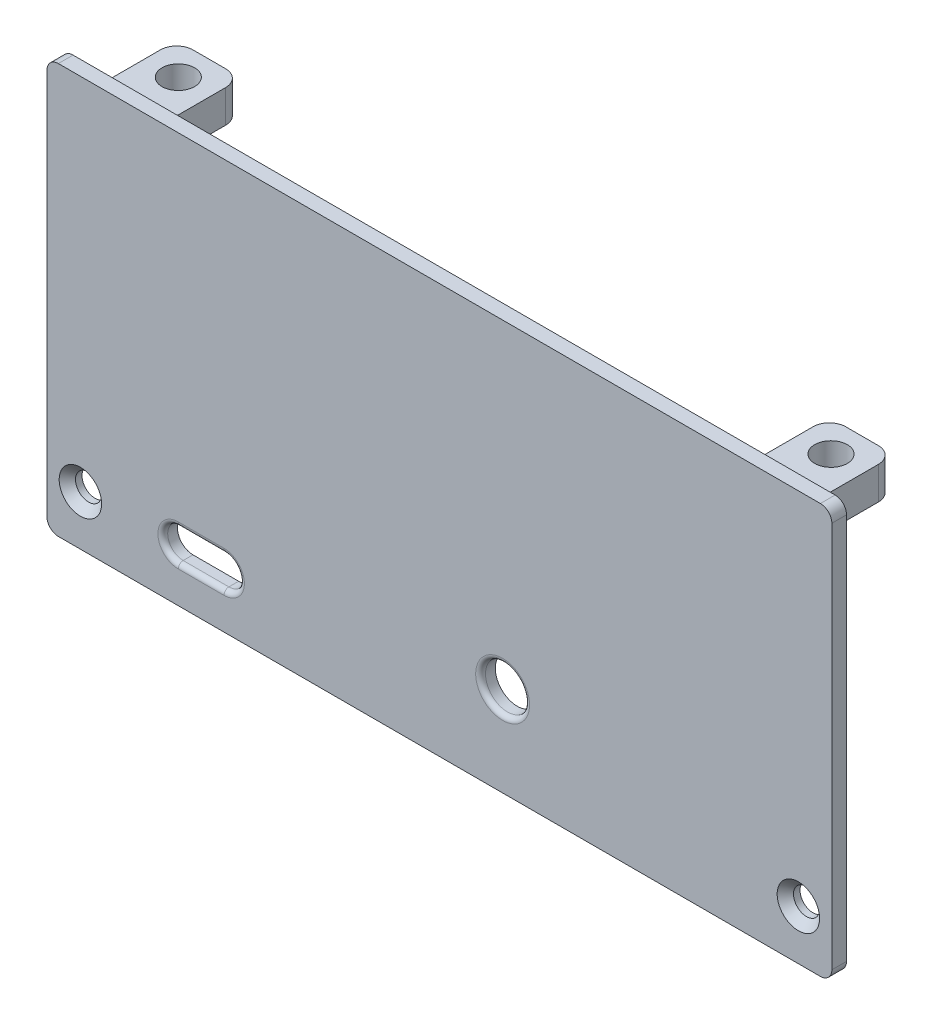
from build123d import *

# Parameters (mm, degrees)
SKETCH1_W            = 97
SKETCH1_H            = 51
SKETCH1_R            = 1.6
BOSS_EXTRUDE1_DEPTH  = 1.8
FILLET1_R            = 2
SKETCH4_W            = 8
SKETCH4_H            = 10
SKETCH4_R            = 2
BOSS_EXTRUDE3_DEPTH  = 4
FILLET2_R            = 2
FILLET2_OF_MIRROR1_R = 2
BOSS_EXTRUDE4_DEPTH  = 7
SKETCH7_R            = 2.7
CUT_EXTRUDE3_DEPTH   = 111.223590941
CUT_EXTRUDE4_DEPTH   = 111.223590941
FILLET3_R            = 0.6
CHAMFER1_SIZE        = 1
SKETCH9_W            = 97
SKETCH9_H            = 51
CUT_EXTRUDE5_DEPTH   = 111.223590941


with BuildPart() as part:
    # Sketch1 → Boss-Extrude1 (new body)
    with BuildSketch(Plane.XY):
        with Locations((48.5, -25.5)):
            Rectangle(SKETCH1_W, SKETCH1_H)
        with Locations((92.5, -44.5)):
            Circle(SKETCH1_R, mode=Mode.SUBTRACT)
        with Locations((4.5, -44.5)):
            Circle(SKETCH1_R, mode=Mode.SUBTRACT)
    extrude(amount=BOSS_EXTRUDE1_DEPTH)

    # Fillet1
    fillet1_edges = [part.edges().sort_by_distance(p)[0] for p in [
        (0, 0, 0.9),
        (97, 0, 0.9),
        (97, -51, 0.9),
        (0, -51, 0.9),
    ]]
    fillet(fillet1_edges, radius=FILLET1_R)

    # Sketch4 → Boss-Extrude3 (add)
    with BuildSketch(Plane(origin=(0, -2.5, 0), x_dir=(1, 0, 0), z_dir=(0, 1, 0))):
        with Locations((88.5, 5)):
            Rectangle(SKETCH4_W, SKETCH4_H)
        with Locations(Location((88.5, 6.2, 0), (0, 0, 270))):
            Circle(SKETCH4_R, mode=Mode.SUBTRACT)
    boss_extrude3 = extrude(amount=-BOSS_EXTRUDE3_DEPTH)

    # Fillet2
    fillet2_edges = [part.edges().sort_by_distance(p)[0] for p in [
        (84.5, -4.5, -10),
        (92.5, -4.5, -10),
    ]]
    fillet(fillet2_edges, radius=FILLET2_R)

    # Mirror1: Boss-Extrude3 across plane
    add(boss_extrude3.mirror(Plane(origin=(48.5, 0, 0), x_dir=(0, 0, 1), z_dir=(1, 0, 0))))

    # Fillet2 of Mirror1
    fillet2_of_mirror1_edges = [part.edges().sort_by_distance(p)[0] for p in [
        (12.5, -4.5, -10),
        (4.5, -4.5, -10),
    ]]
    fillet(fillet2_of_mirror1_edges, radius=FILLET2_OF_MIRROR1_R)

    # Sketch5 → Boss-Extrude4 (add)
    with BuildSketch(Plane(origin=(0, 0, 0), x_dir=(-1, 0, 0), z_dir=(0, 0, -1))):
        with BuildLine():
            Line((-89.15, -10), (-89.15, -31.3))
            ThreePointArc((-89.15, -31.3), (-88.564213562, -32.714213562), (-87.15, -33.3))
            Line((-87.15, -33.3), (-9.85, -33.3))
            ThreePointArc((-9.85, -33.3), (-8.435786438, -32.714213562), (-7.85, -31.3))
            Line((-7.85, -31.3), (-7.85, -10))
            ThreePointArc((-7.85, -10), (-8.435786438, -8.585786438), (-9.85, -8))
            Line((-9.85, -8), (-87.15, -8))
            ThreePointArc((-87.15, -8), (-88.564213562, -8.585786438), (-89.15, -10))
        make_face()
        with BuildLine():
            Line((-86.65, -10), (-10.35, -10))
            ThreePointArc((-10.35, -10), (-9.496446609, -9.646446609), (-9.85, -10.5))
            Line((-9.85, -10.5), (-9.85, -30.8))
            ThreePointArc((-9.85, -30.8), (-9.496446609, -31.653553391), (-10.35, -31.3))
            Line((-10.35, -31.3), (-86.65, -31.3))
            ThreePointArc((-86.65, -31.3), (-87.503553391, -31.653553391), (-87.15, -30.8))
            Line((-87.15, -30.8), (-87.15, -10.5))
            ThreePointArc((-87.15, -10.5), (-87.503553391, -9.646446609), (-86.65, -10))
        make_face(mode=Mode.SUBTRACT)
    extrude(amount=BOSS_EXTRUDE4_DEPTH)

    # Sketch7 → Cut-Extrude3 (cut, through all)
    with BuildSketch(Plane.XY.offset(1.8)):
        with Locations((56.25, -39.6)):
            Circle(SKETCH7_R)
    extrude(amount=-CUT_EXTRUDE3_DEPTH, mode=Mode.SUBTRACT)

    # Sketch8 → Cut-Extrude4 (cut, through all)
    with BuildSketch(Plane.XY.offset(1.8)):
        with BuildLine():
            Line((16.5, -42.3), (22.1, -42.3))
            ThreePointArc((22.1, -42.3), (24, -44.2), (22.1, -46.1))
            Line((22.1, -46.1), (16.5, -46.1))
            ThreePointArc((16.5, -46.1), (14.6, -44.2), (16.5, -42.3))
        make_face()
    extrude(amount=-CUT_EXTRUDE4_DEPTH, mode=Mode.SUBTRACT)

    # Fillet3
    fillet3_edges = [part.edges().sort_by_distance(p)[0] for p in [
        (53.55, -39.6, 1.8),
        (14.6, -44.2, 1.8),
        (19.3, -46.1, 1.8),
        (24, -44.2, 1.8),
        (19.3, -42.3, 1.8),
    ]]
    fillet(fillet3_edges, radius=FILLET3_R)

    # Chamfer1
    chamfer1_edges = [part.edges().sort_by_distance(p)[0] for p in [
        (90.9, -44.5, 1.8),
        (2.9, -44.5, 1.8),
    ]]
    chamfer(chamfer1_edges, length=CHAMFER1_SIZE)

    # Sketch9 → Cut-Extrude5 (cut, through all)
    with BuildSketch(Plane.XY.offset(1.8)):
        with Locations((48.5, -25.5)):
            Rectangle(SKETCH9_W, SKETCH9_H)
        with BuildLine():
            Line((0.4, -1.8), (0.4, -49.2))
            ThreePointArc((0.4, -49.2), (0.810050506, -50.189949494), (1.8, -50.6))
            Line((1.8, -50.6), (95.2, -50.6))
            ThreePointArc((95.2, -50.6), (96.189949494, -50.189949494), (96.6, -49.2))
            Line((96.6, -49.2), (96.6, -1.8))
            ThreePointArc((96.6, -1.8), (96.189949494, -0.810050506), (95.2, -0.4))
            Line((95.2, -0.4), (1.8, -0.4))
            ThreePointArc((1.8, -0.4), (0.810050506, -0.810050506), (0.4, -1.8))
        make_face(mode=Mode.SUBTRACT)
    extrude(amount=-CUT_EXTRUDE5_DEPTH, mode=Mode.SUBTRACT)


solid = part.part
